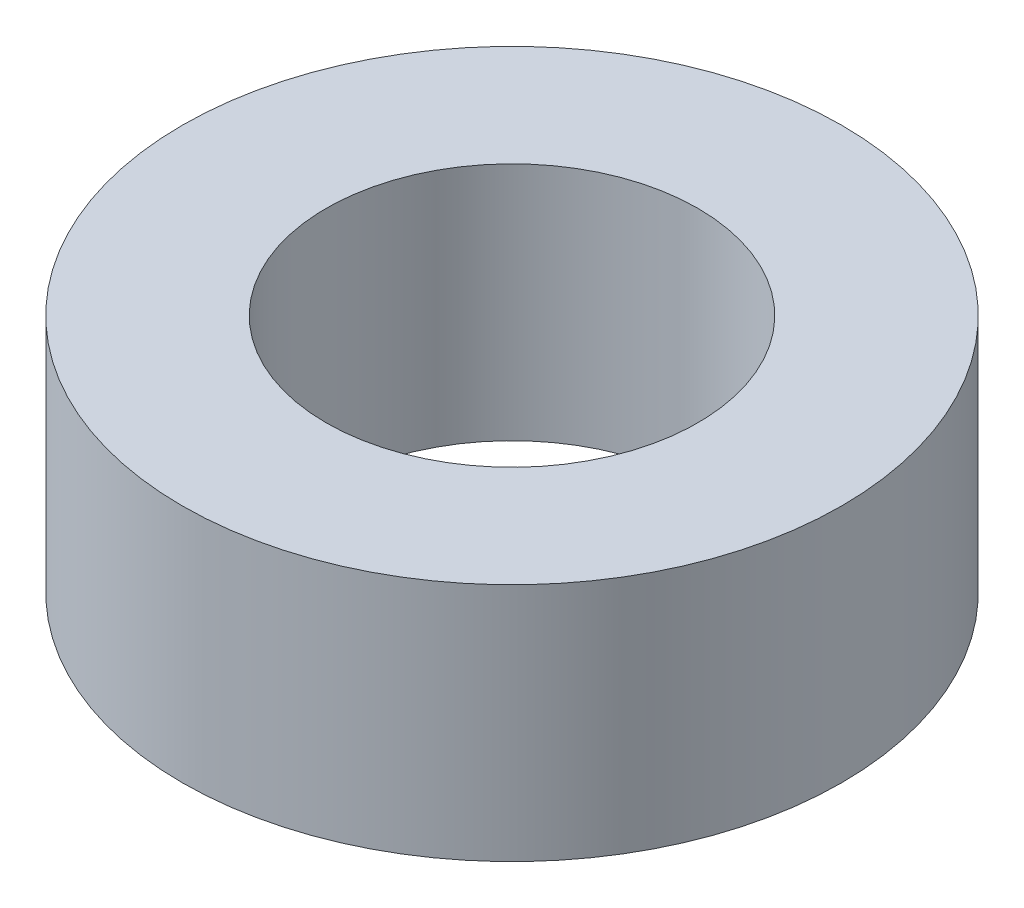
from build123d import *

# Parameters (mm, degrees)
SKETCH1_R           = 2.75
SKETCH1_R_2         = 1.55
BOSS_EXTRUDE1_DEPTH = 2


with BuildPart() as part:
    # Sketch1 → Boss-Extrude1 (new body)
    with BuildSketch(Plane(origin=(0, 0, 0), x_dir=(1, 0, 0), z_dir=(0, 1, 0))):
        with Locations(Location((0, 0, 0), (0, 0, 270))):
            Circle(SKETCH1_R)
        with Locations(Location((0, 0, 0), (0, 0, 270))):
            Circle(SKETCH1_R_2, mode=Mode.SUBTRACT)
    extrude(amount=BOSS_EXTRUDE1_DEPTH)


solid = part.part
